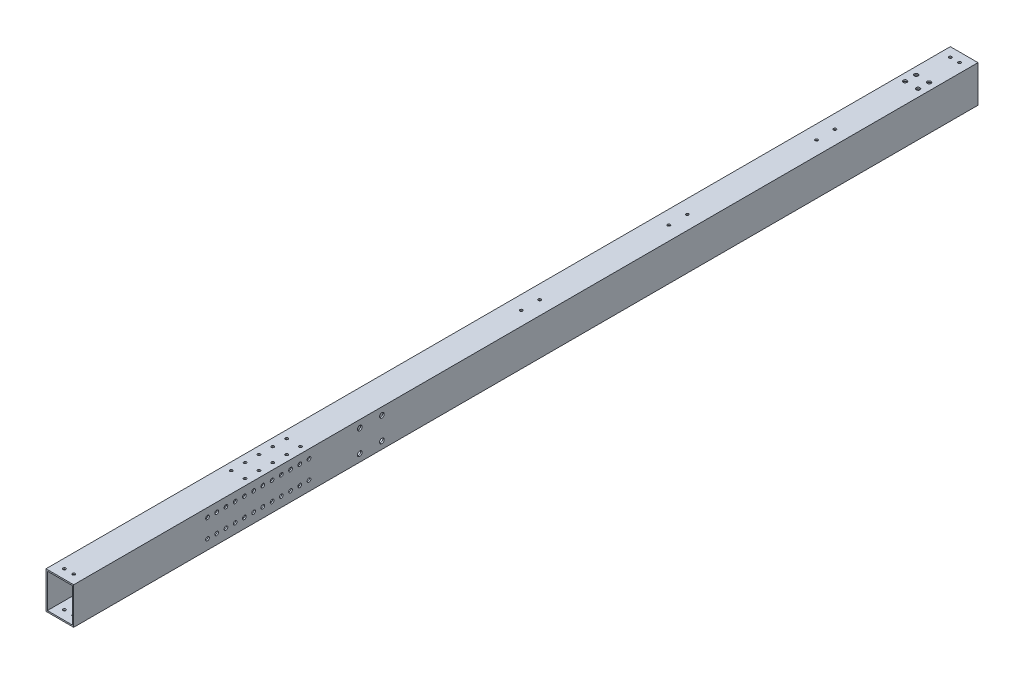
from build123d import *

# Parameters (mm, degrees)
SKETCH_1_W             = 30
SKETCH_1_H             = 40
SKETCH_1_W_2           = 27
SKETCH_1_H_2           = 37
EXTRUDE_1_DEPTH        = 980
SKETCH_3_R             = 1.5
CUT_EXTRUDE_2_DEPTH    = 981.930680527
SKETCH_4_R             = 1.5
CUT_EXTRUDE_3_DEPTH    = 981.930680527
SKETCH_5_R             = 1.5
CUT_EXTRUDE_4_DEPTH    = 981.930680527
CUT_EXTRUDE_6_DEPTH    = 10
SKETCH_9_R             = 3.25
CUT_EXTRUDE_7_DEPTH    = 10
PATTERN_LINEAR_1_COUNT = 4
PATTERN_LINEAR_1_PITCH = 15
SKETCH_10_R            = 2.55
CUT_EXTRUDE_8_DEPTH    = 51
SKETCH_11_R            = 2
CUT_EXTRUDE_9_DEPTH    = 51
SKETCH_12_R            = 2.1
CUT_EXTRUDE_10_DEPTH   = 10
CUT_EXTRUDE_11_DEPTH   = 10


with BuildPart() as part:
    # 草图1 → 凸台-拉伸1 (new body)
    with BuildSketch(Plane.XY):
        Rectangle(SKETCH_1_W, SKETCH_1_H)
        Rectangle(SKETCH_1_W_2, SKETCH_1_H_2, mode=Mode.SUBTRACT)
    extrude(amount=EXTRUDE_1_DEPTH)

    # 草图3 → 切除-拉伸2 (cut, through all)
    with BuildSketch(Plane(origin=(0, 20, 0), x_dir=(-1, 0, 0), z_dir=(0, -1, 0))):
        with Locations(Location((5, -10, 0), (0, 0, 180))):
            Circle(SKETCH_3_R)
        with Locations(Location((-5, -10, 0), (0, 0, 270))):
            Circle(SKETCH_3_R)
        with Locations(Location((-5, -970, 0), (0, 0, 180))):
            Circle(SKETCH_3_R)
        with Locations(Location((5, -970, 0), (0, 0, 270))):
            Circle(SKETCH_3_R)
    extrude(amount=CUT_EXTRUDE_2_DEPTH, mode=Mode.SUBTRACT)

    # 草图4 → 切除-拉伸3 (cut, through all)
    with BuildSketch(Plane(origin=(0, 20, 0), x_dir=(-1, 0, 0), z_dir=(0, -1, 0))):
        with Locations(Location((-8.27006126, -772.5, 0), (0, 0, 180))):
            Circle(SKETCH_4_R)
        with Locations(Location((6.72993874, -772.5, 0), (0, 0, 270))):
            Circle(SKETCH_4_R)
        with Locations(Location((6.72993874, -787.5, 0), (0, 0, 180))):
            Circle(SKETCH_4_R)
        with Locations(Location((-8.27006126, -787.5, 0), (0, 0, 270))):
            Circle(SKETCH_4_R)
    cut_extrude_3 = extrude(amount=CUT_EXTRUDE_3_DEPTH, mode=Mode.SUBTRACT)

    # 草图5 → 切除-拉伸4 (cut, through all)
    with BuildSketch(Plane(origin=(0, 20, 0), x_dir=(-1, 0, 0), z_dir=(0, -1, 0))):
        with Locations(Location((0, -140, 0), (0, 0, 180))):
            Circle(SKETCH_5_R)
        with Locations(Location((0, -160, 0), (0, 0, 180))):
            Circle(SKETCH_5_R)
        with Locations(Location((0, -300, 0), (0, 0, 180))):
            Circle(SKETCH_5_R)
        with Locations(Location((0, -320, 0), (0, 0, 180))):
            Circle(SKETCH_5_R)
        with Locations(Location((0, -480, 0), (0, 0, 180))):
            Circle(SKETCH_5_R)
        with Locations(Location((0, -460, 0), (0, 0, 180))):
            Circle(SKETCH_5_R)
    extrude(amount=CUT_EXTRUDE_4_DEPTH, mode=Mode.SUBTRACT)

    # 草图8 → 切除-拉伸6 (cut)
    with BuildSketch(Plane.XZ.offset(20)):
        with BuildLine():
            Line((7.5, 160), (7.5, 140))
            ThreePointArc((7.5, 140), (0, 132.5), (-7.5, 140))
            Line((-7.5, 140), (-7.5, 160))
            ThreePointArc((-7.5, 160), (0, 167.5), (7.5, 160))
        make_face()
        with BuildLine():
            Line((7.5, 480), (7.5, 460))
            ThreePointArc((7.5, 460), (0, 452.5), (-7.5, 460))
            Line((-7.5, 460), (-7.5, 480))
            ThreePointArc((-7.5, 480), (0, 487.5), (7.5, 480))
        make_face()
        with BuildLine():
            Line((7.5, 320), (7.5, 300))
            ThreePointArc((7.5, 300), (0, 292.5), (-7.5, 300))
            Line((-7.5, 300), (-7.5, 320))
            ThreePointArc((-7.5, 320), (0, 327.5), (7.5, 320))
        make_face()
    extrude(amount=-CUT_EXTRUDE_6_DEPTH, mode=Mode.SUBTRACT)

    # 草图9 → 切除-拉伸7 (cut)
    with BuildSketch(Plane.XZ.offset(20)):
        with Locations(Location((-6.72993874, 787.5, 0), (0, 0, 270))):
            Circle(SKETCH_9_R)
        with Locations(Location((-6.72993874, 772.5, 0), (0, 0, 270))):
            Circle(SKETCH_9_R)
        with Locations(Location((8.27006126, 772.5, 0), (0, 0, 270))):
            Circle(SKETCH_9_R)
        with Locations(Location((8.27006126, 787.5, 0), (0, 0, 270))):
            Circle(SKETCH_9_R)
    cut_extrude_7 = extrude(amount=-CUT_EXTRUDE_7_DEPTH, mode=Mode.SUBTRACT)

    # 阵列(线性)1: 切除-拉伸3, 切除-拉伸7 ×4
    with Locations(*[(0, 0, -i * PATTERN_LINEAR_1_PITCH) for i in range(1, PATTERN_LINEAR_1_COUNT)]):
        add(cut_extrude_3, mode=Mode.SUBTRACT)
        add(cut_extrude_7, mode=Mode.SUBTRACT)

    # 草图10 → 切除-拉伸8 (cut)
    with BuildSketch(Plane.ZY.offset(15)):
        with Locations((646, 12)):
            Circle(SKETCH_10_R)
        with Locations((670, 12)):
            Circle(SKETCH_10_R)
        with Locations((646, -12)):
            Circle(SKETCH_10_R)
        with Locations((670, -12)):
            Circle(SKETCH_10_R)
    extrude(amount=-CUT_EXTRUDE_8_DEPTH, mode=Mode.SUBTRACT)

    # 草图11 → 切除-拉伸9 (cut)
    with BuildSketch(Plane.ZY.offset(15)):
        with Locations((725, 10.625214933)):
            Circle(SKETCH_11_R)
        with Locations((725, -9.374785067)):
            Circle(SKETCH_11_R)
        with Locations((735, 10.625214933)):
            Circle(SKETCH_11_R)
        with Locations((735, -9.374785067)):
            Circle(SKETCH_11_R)
        with Locations((745, 10.625214933)):
            Circle(SKETCH_11_R)
        with Locations((745, -9.374785067)):
            Circle(SKETCH_11_R)
        with Locations((755, 10.625214933)):
            Circle(SKETCH_11_R)
        with Locations((755, -9.374785067)):
            Circle(SKETCH_11_R)
        with Locations((765, 10.625214933)):
            Circle(SKETCH_11_R)
        with Locations((765, -9.374785067)):
            Circle(SKETCH_11_R)
        with Locations((775, 10.625214933)):
            Circle(SKETCH_11_R)
        with Locations((775, -9.374785067)):
            Circle(SKETCH_11_R)
        with Locations((785, 10.625214933)):
            Circle(SKETCH_11_R)
        with Locations((785, -9.374785067)):
            Circle(SKETCH_11_R)
        with Locations((795, 10.625214933)):
            Circle(SKETCH_11_R)
        with Locations((795, -9.374785067)):
            Circle(SKETCH_11_R)
        with Locations((805, 10.625214933)):
            Circle(SKETCH_11_R)
        with Locations((805, -9.374785067)):
            Circle(SKETCH_11_R)
        with Locations((815, 10.625214933)):
            Circle(SKETCH_11_R)
        with Locations((815, -9.374785067)):
            Circle(SKETCH_11_R)
        with Locations((825, 10.625214933)):
            Circle(SKETCH_11_R)
        with Locations((825, -9.374785067)):
            Circle(SKETCH_11_R)
        with Locations((835, 10.625214933)):
            Circle(SKETCH_11_R)
        with Locations((835, -9.374785067)):
            Circle(SKETCH_11_R)
    extrude(amount=-CUT_EXTRUDE_9_DEPTH, mode=Mode.SUBTRACT)

    # 草图12 → 切除-拉伸10 (cut)
    with BuildSketch(Plane(origin=(0, 20, 0), x_dir=(1, 0, 0), z_dir=(0, 1, 0))):
        with Locations(Location((-7, -45, 0), (0, 0, 270))):
            Circle(SKETCH_12_R)
        with Locations(Location((-7, -57, 0), (0, 0, 270))):
            Circle(SKETCH_12_R)
        with Locations((7, -57)):
            Circle(SKETCH_12_R)
        with Locations((7, -45)):
            Circle(SKETCH_12_R)
    extrude(amount=-CUT_EXTRUDE_10_DEPTH, mode=Mode.SUBTRACT)

    # 草图13 → 切除-拉伸11 (cut)
    with BuildSketch(Plane.XZ.offset(20)):
        with BuildLine():
            Line((-9, 27.5), (-9, 72.5))
            ThreePointArc((-9, 72.5), (0, 81.5), (9, 72.5))
            Line((9, 72.5), (9, 27.5))
            ThreePointArc((9, 27.5), (0, 18.5), (-9, 27.5))
        make_face()
    extrude(amount=-CUT_EXTRUDE_11_DEPTH, mode=Mode.SUBTRACT)


solid = part.part
